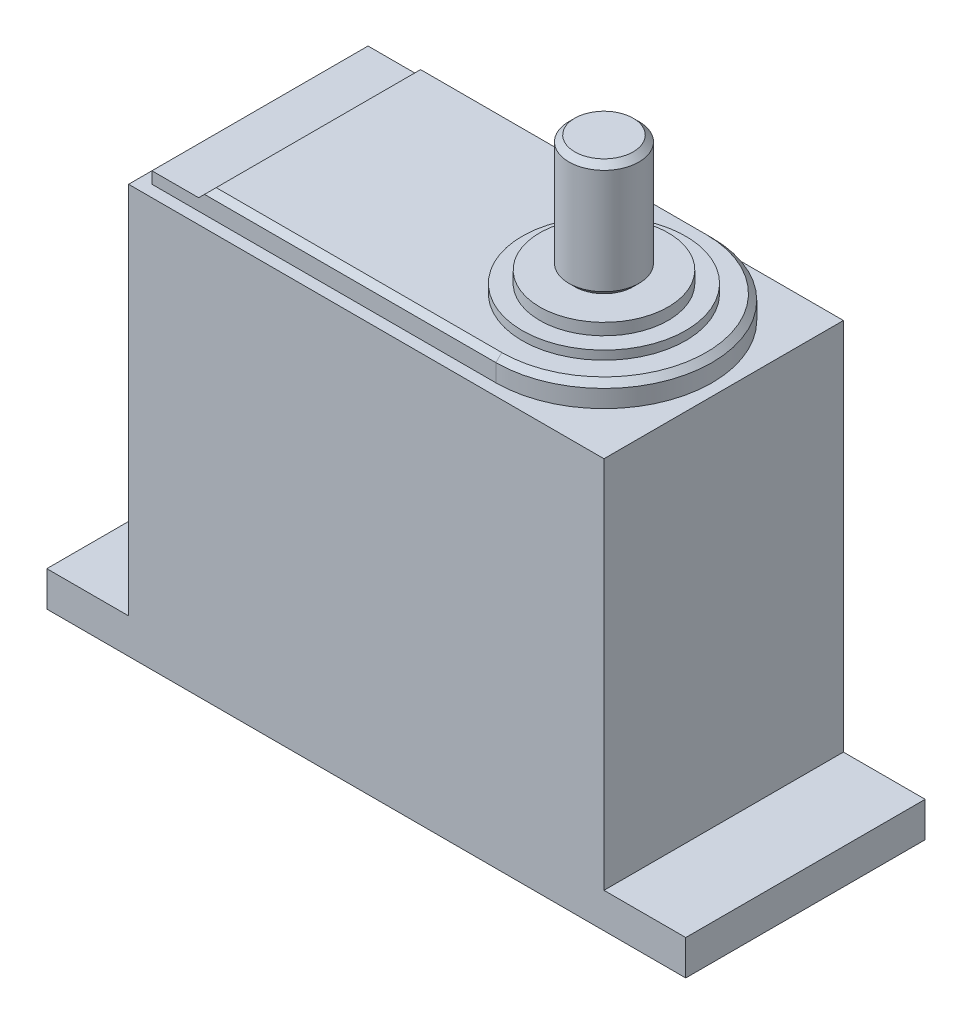
from build123d import *

# Parameters (mm, degrees)
SKETCH_1_W              = 40.7
SKETCH_1_H              = 35
EXTRUDE_BOSS_DEPTH      = 10.25
EXTRUDE_2_DEPTH         = 2
EXTRUDE_CUT_DEPTH       = 18.5
CROQUIS10_R             = 7
SALIENTE_EXTRUIR5_DEPTH = 0.75
CROQUIS11_R             = 5.5
SALIENTE_EXTRUIR6_DEPTH = 1
CROQUIS12_R             = 3
SALIENTE_EXTRUIR7_DEPTH = 10
CHAFL_N2_SIZE           = 0.5
SKETCH1_W               = 7
SKETCH1_H               = 20.5
BOSS_EXTRUDE1_DEPTH     = 3


with BuildPart() as part:
    # Sketch 1 → Extrude Boss (new, symmetric)
    with BuildSketch(Plane.XY):
        Rectangle(SKETCH_1_W, SKETCH_1_H)
    extrude(amount=EXTRUDE_BOSS_DEPTH, both=True)

    # Sketch 3 → Extrude 2 (add)
    with BuildSketch(Plane(origin=(0, 17.5, 0), x_dir=(1, 0, 0), z_dir=(0, 1, 0))):
        with BuildLine():
            Line((10.1, 9.25), (-19.35, 9.25))
            Line((-19.35, 9.25), (-19.35, -9.25))
            Line((-19.35, -9.25), (10.1, -9.25))
            ThreePointArc((10.1, -9.25), (19.35, 0), (10.1, 9.25))
        make_face()
    extrude(amount=EXTRUDE_2_DEPTH)

    # Sketch 4 → Extrude Cut (cut)
    with BuildSketch(Plane.XY.offset(9.25)):
        Polygon((-19.35, 19.5), (-19.35, 18.5), (-15.35, 18.5), (-14.35, 19.5), align=None)
    extrude(amount=-EXTRUDE_CUT_DEPTH, mode=Mode.SUBTRACT)

    # Croquis10 → Saliente-Extruir5 (add)
    with BuildSketch(Plane(origin=(0, 19.5, 0), x_dir=(1, 0, 0), z_dir=(0, 1, 0))):
        with Locations(Location((10.1, 0, 0), (0, 0, 270))):
            Circle(CROQUIS10_R)
    extrude(amount=SALIENTE_EXTRUIR5_DEPTH)

    # Croquis11 → Saliente-Extruir6 (add)
    with BuildSketch(Plane(origin=(0, 20.25, 0), x_dir=(1, 0, 0), z_dir=(0, 1, 0))):
        with Locations(Location((10.1, 0, 0), (0, 0, 270))):
            Circle(CROQUIS11_R)
    extrude(amount=SALIENTE_EXTRUIR6_DEPTH)

    # Croquis12 → Saliente-Extruir7 (add)
    with BuildSketch(Plane(origin=(0, 21.25, 0), x_dir=(1, 0, 0), z_dir=(0, 1, 0))):
        with Locations(Location((10.1, 0, 0), (0, 0, 270))):
            Circle(CROQUIS12_R)
    extrude(amount=SALIENTE_EXTRUIR7_DEPTH)

    # Chaflán2
    chafl_n2_edges = [part.edges().sort_by_distance(p)[0] for p in [
        (19.35, 19.5, 0),
        (-2.125, 19.5, -9.25),
        (-2.125, 19.5, 9.25),
        (10.1, 31.25, -3),
    ]]
    chamfer(chafl_n2_edges, length=CHAFL_N2_SIZE)

    # Croquis13 → Cortar-Revolución1 (revolve, cut)
    with BuildSketch(Plane.XY, mode=Mode.PRIVATE) as cortar_revoluci_n1_sk:
        Polygon((7.1, 21.75), (7.1, 21.25), (7.6, 21.25), align=None)
    revolve(cortar_revoluci_n1_sk.sketch.rotate(Axis((10.1, 31.25, 0), (0, -1, 0)), 270), axis=Axis((10.1, 31.25, 0), (0, -1, 0)), mode=Mode.SUBTRACT)

    # Sketch1 → Boss-Extrude1 (add)
    with BuildSketch(Plane.XZ.offset(17.5)):
        with Locations((-23.85, 0)):
            Rectangle(SKETCH1_W, SKETCH1_H)
        with Locations((23.85, 0)):
            Rectangle(SKETCH1_W, SKETCH1_H)
    extrude(amount=-BOSS_EXTRUDE1_DEPTH)


solid = part.part
